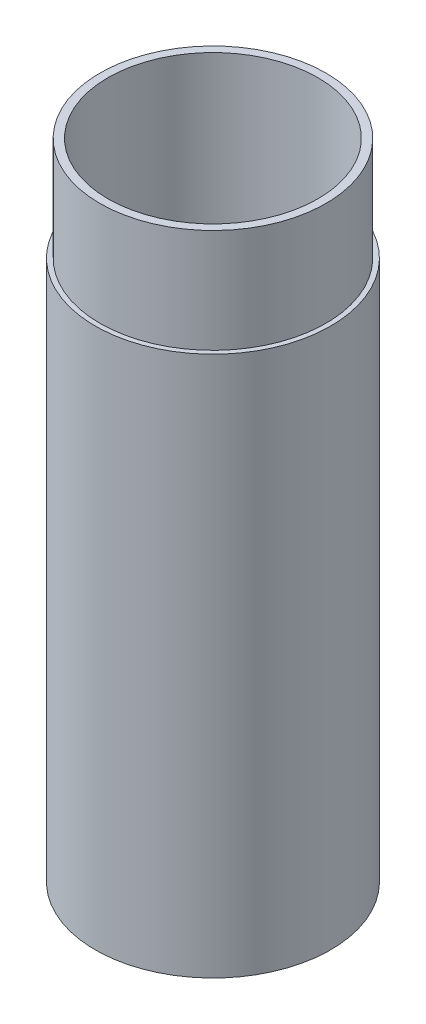
from build123d import *

# Parameters (mm, degrees)
SKETCH_1_R      = 24.95
SKETCH_1_R_2    = 22.25
EXTRUDE_1_DEPTH = 114.5
SKETCH_2_R      = 23.95
SKETCH_2_R_2    = 22.25
EXTRUDE_2_DEPTH = 22
CHAMFER_1_SIZE  = 1
FILLET_1_R      = 1


with BuildPart() as part:
    # 草图1 → 凸台-拉伸1 (new body)
    with BuildSketch(Plane(origin=(0, 0, 0), x_dir=(1, 0, 0), z_dir=(0, 1, 0))):
        with Locations(Location((0, 0, 0), (0, 0, 90))):
            Circle(SKETCH_1_R)
        with Locations(Location((0, 0, 0), (0, 0, 90))):
            Circle(SKETCH_1_R_2, mode=Mode.SUBTRACT)
    extrude(amount=EXTRUDE_1_DEPTH)

    # 草图2 → 凸台-拉伸2 (add)
    with BuildSketch(Plane(origin=(0, 114.5, 0), x_dir=(1, 0, 0), z_dir=(0, 1, 0))):
        with Locations(Location((0, 0, 0), (0, 0, 270))):
            Circle(SKETCH_2_R)
        with Locations(Location((0, 0, 0), (0, 0, 90))):
            Circle(SKETCH_2_R_2, mode=Mode.SUBTRACT)
    extrude(amount=EXTRUDE_2_DEPTH)

    # 倒角1
    chamfer_1_edges = [part.edges().sort_by_distance(p)[0] for p in [
        (0, 0, 22.25),
    ]]
    chamfer(chamfer_1_edges, length=CHAMFER_1_SIZE)

    # 圆角1
    fillet_1_edges = [part.edges().sort_by_distance(p)[0] for p in [
        (0, 0, 23.25),
        (0, 1, 22.25),
    ]]
    fillet(fillet_1_edges, radius=FILLET_1_R)


solid = part.part
